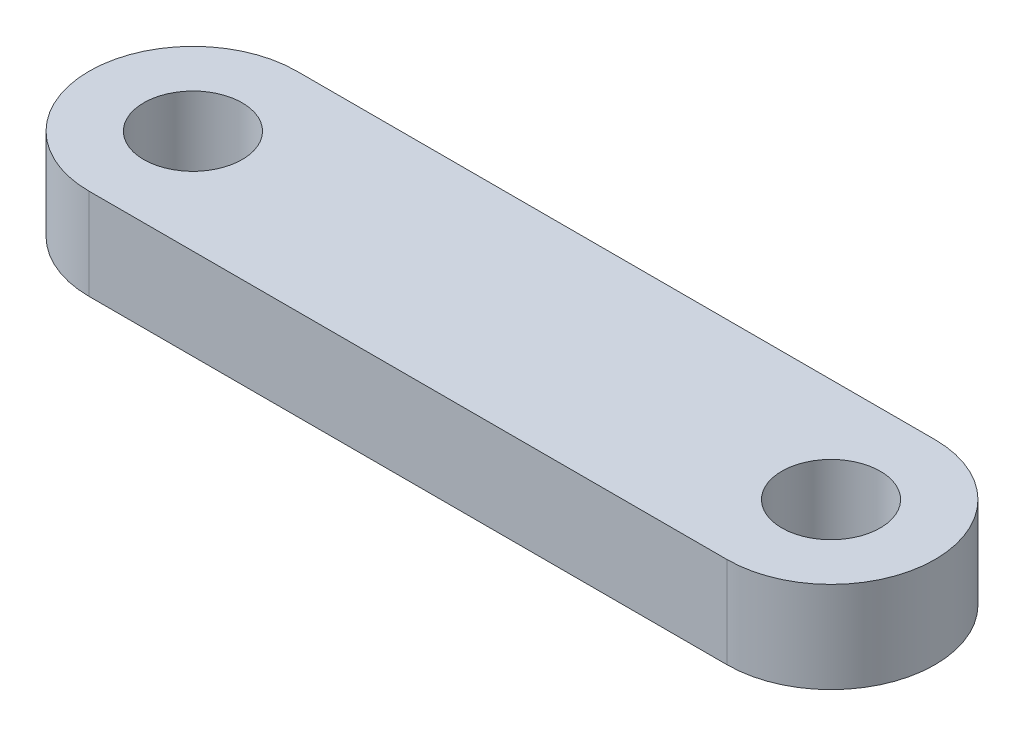
from build123d import *

# Parameters (mm, degrees)
SKETCH1_R           = 2.7
BOSS_EXTRUDE2_DEPTH = 5


with BuildPart() as part:
    # Sketch1 → Boss-Extrude2 (new body)
    with BuildSketch(Plane(origin=(0, 0, 0), x_dir=(1, 0, 0), z_dir=(0, 1, 0))):
        with BuildLine():
            ThreePointArc((-32.319982325, 8.019982325), (-38.019982325, 2.319982325), (-32.319982325, -3.380017675))
            Line((-32.319982325, -3.380017675), (2.680017675, -3.380017675))
            ThreePointArc((2.680017675, -3.380017675), (8.380017675, 2.319982325), (2.680017675, 8.019982325))
            Line((2.680017675, 8.019982325), (-32.319982325, 8.019982325))
        make_face()
        with Locations(Location((-32.319982325, 2.319982325, 0), (0, 0, 270))):
            Circle(SKETCH1_R, mode=Mode.SUBTRACT)
        with Locations(Location((2.680017675, 2.319982325, 0), (0, 0, 270))):
            Circle(SKETCH1_R, mode=Mode.SUBTRACT)
    extrude(amount=BOSS_EXTRUDE2_DEPTH)


solid = part.part
